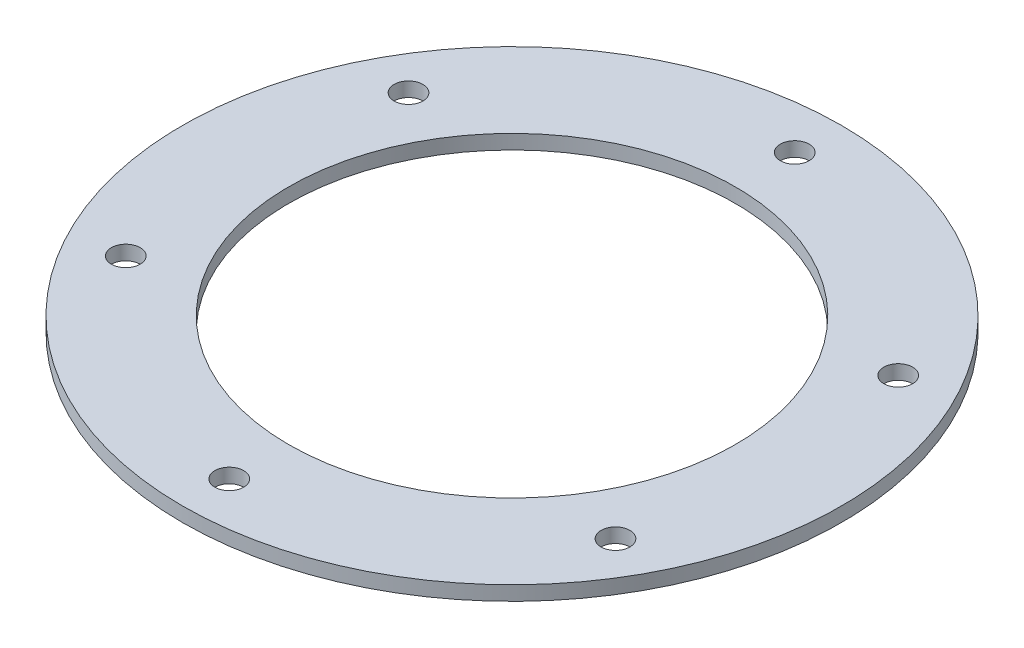
from build123d import *

# Parameters (mm, degrees)
SKETCH1_R           = 45.75
SKETCH1_R_2         = 31
SKETCH1_R_3         = 2
BOSS_EXTRUDE1_DEPTH = 1


with BuildPart() as part:
    # Sketch1 → Boss-Extrude1 (new, symmetric)
    with BuildSketch(Plane(origin=(0, 0, 0), x_dir=(1, 0, 0), z_dir=(0, 1, 0))):
        with Locations(Location((0, 0, 0), (0, 0, 270))):
            Circle(SKETCH1_R)
        with Locations(Location((0, 0, 0), (0, 0, 270))):
            Circle(SKETCH1_R_2, mode=Mode.SUBTRACT)
        with Locations(Location((0, 39.25, 0), (0, 0, 270))):
            Circle(SKETCH1_R_3, mode=Mode.SUBTRACT)
        with Locations(Location((33.991497099, 19.625, 0), (0, 0, 270))):
            Circle(SKETCH1_R_3, mode=Mode.SUBTRACT)
        with Locations(Location((33.991497099, -19.625, 0), (0, 0, 270))):
            Circle(SKETCH1_R_3, mode=Mode.SUBTRACT)
        with Locations(Location((0, -39.25, 0), (0, 0, 270))):
            Circle(SKETCH1_R_3, mode=Mode.SUBTRACT)
        with Locations(Location((-33.991497099, -19.625, 0), (0, 0, 270))):
            Circle(SKETCH1_R_3, mode=Mode.SUBTRACT)
        with Locations(Location((-33.991497099, 19.625, 0), (0, 0, 270))):
            Circle(SKETCH1_R_3, mode=Mode.SUBTRACT)
    extrude(amount=BOSS_EXTRUDE1_DEPTH, both=True)


solid = part.part
